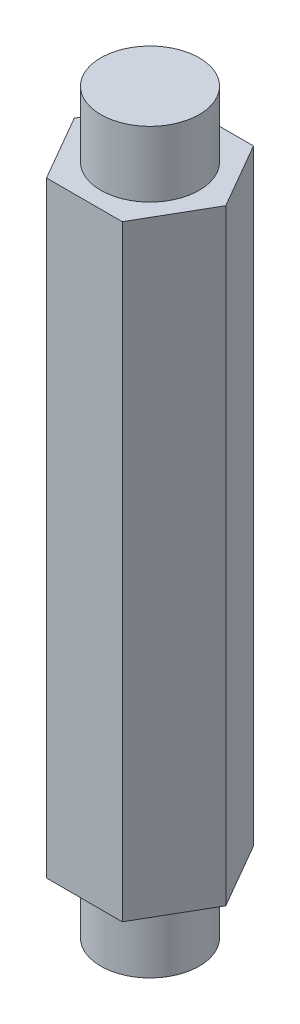
from build123d import *

# Parameters (mm, degrees)
SALIENTE_EXTRUIR1_DEPTH = 58.68
CROQUIS2_R              = 4.7625
SALIENTE_EXTRUIR2_DEPTH = 6.35
SALIENTE_EXTRUIR3_START = 6.35
CROQUIS3_R              = 4.7625
SALIENTE_EXTRUIR3_DEPTH = 6.35


with BuildPart() as part:
    # Croquis1 → Saliente-Extruir1 (new body)
    with BuildSketch(Plane(origin=(0, 0, 0), x_dir=(1, 0, 0), z_dir=(0, 1, 0))):
        Polygon((7.332348419, 0), (3.666174209, 6.35), (-3.666174209, 6.35), (-7.332348419, 0), (-3.666174209, -6.35), (3.666174209, -6.35), align=None)
    extrude(amount=SALIENTE_EXTRUIR1_DEPTH)

    # Croquis2 → Saliente-Extruir2 (add)
    with BuildSketch(Plane(origin=(0, 58.68, 0), x_dir=(1, 0, 0), z_dir=(0, 1, 0))):
        with Locations(Location((0, 0, 0), (0, 0, 270))):
            Circle(CROQUIS2_R)
    extrude(amount=SALIENTE_EXTRUIR2_DEPTH)

    # Croquis3 → Saliente-Extruir3 (add)
    with BuildSketch(Plane.XZ.offset(SALIENTE_EXTRUIR3_START)):
        with Locations(Location((0, 0, 0), (0, 0, 90))):
            Circle(CROQUIS3_R)
    extrude(amount=-SALIENTE_EXTRUIR3_DEPTH)


solid = part.part
